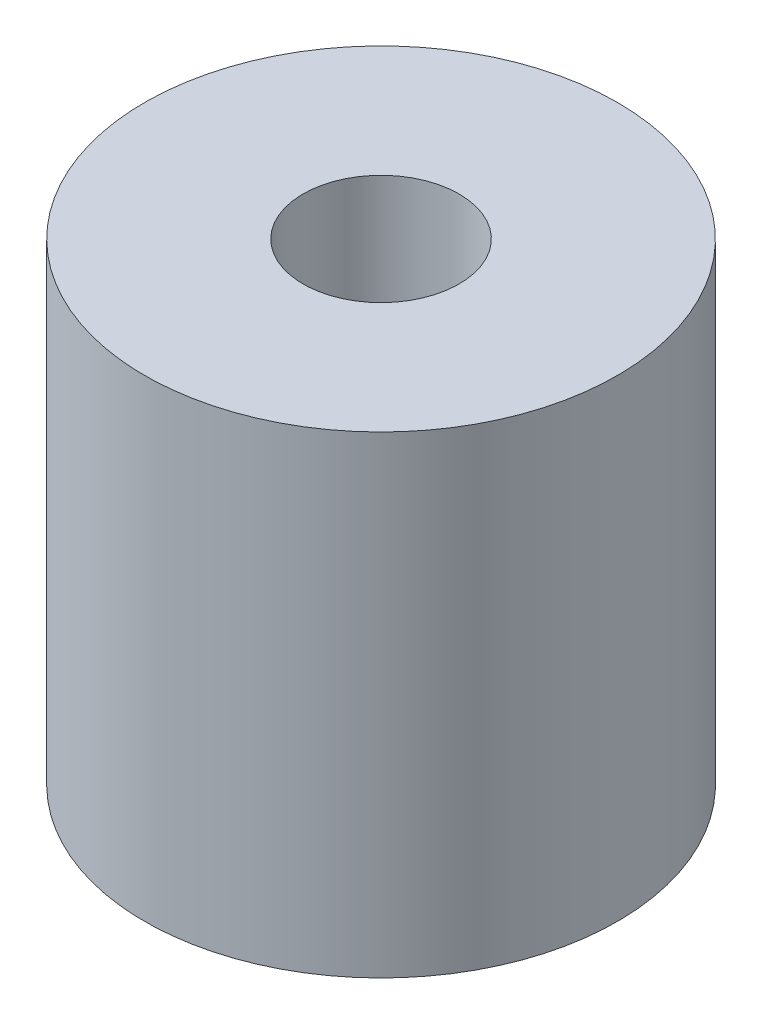
from build123d import *

# Parameters (mm, degrees)
SKETCH_1_R         = 5
EXTRUDE_1_DEPTH    = 5
HOLE_WIZARD_M4_1_D = 3.3


with BuildPart() as part:
    # 草图1 → 凸台-拉伸1 (new, symmetric)
    with BuildSketch(Plane(origin=(0, 0, 0), x_dir=(1, 0, 0), z_dir=(0, 1, 0))):
        with Locations(Location((0, 0, 0), (0, 0, 270))):
            Circle(SKETCH_1_R)
    extrude(amount=EXTRUDE_1_DEPTH, both=True)

    # M4 螺纹孔1 (through all)
    with Locations(Plane(origin=(0, 5, 0), x_dir=(1, 0, 0), z_dir=(0, 1, 0))):
        with Locations((0, 0)):
            Hole(HOLE_WIZARD_M4_1_D / 2)


solid = part.part
